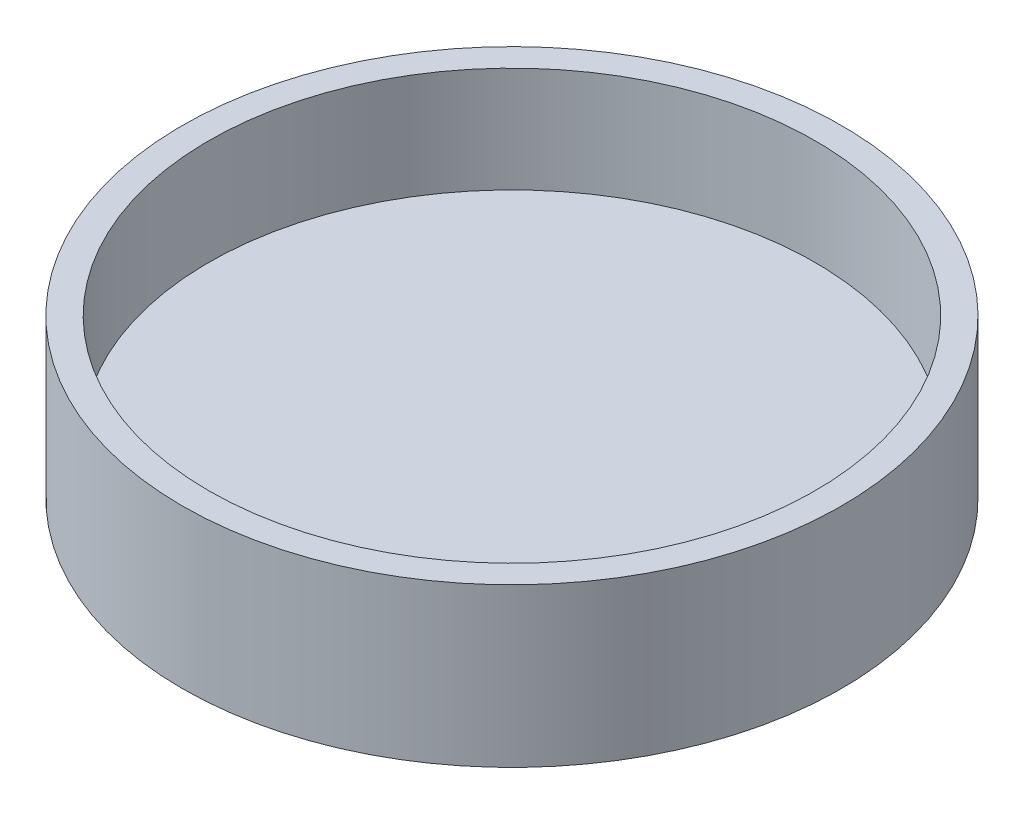
from build123d import *

# Parameters (mm, degrees)
SKETCH1_R           = 158.75
BOSS_EXTRUDE1_DEPTH = 25.4
SKETCH2_R           = 158.75
SKETCH2_R_2         = 146.05
BOSS_EXTRUDE2_DEPTH = 50.8


with BuildPart() as part:
    # Sketch1 → Boss-Extrude1 (new body)
    with BuildSketch(Plane(origin=(0, 0, 0), x_dir=(1, 0, 0), z_dir=(0, 1, 0))):
        with Locations(Location((0, 0, 0), (0, 0, 270))):
            Circle(SKETCH1_R)
    extrude(amount=BOSS_EXTRUDE1_DEPTH)

    # Sketch2 → Boss-Extrude2 (add)
    with BuildSketch(Plane(origin=(0, 25.4, 0), x_dir=(1, 0, 0), z_dir=(0, 1, 0))):
        with Locations(Location((0, 0, 0), (0, 0, 270))):
            Circle(SKETCH2_R)
        with Locations(Location((0, 0, 0), (0, 0, 270))):
            Circle(SKETCH2_R_2, mode=Mode.SUBTRACT)
    extrude(amount=BOSS_EXTRUDE2_DEPTH)


solid = part.part
